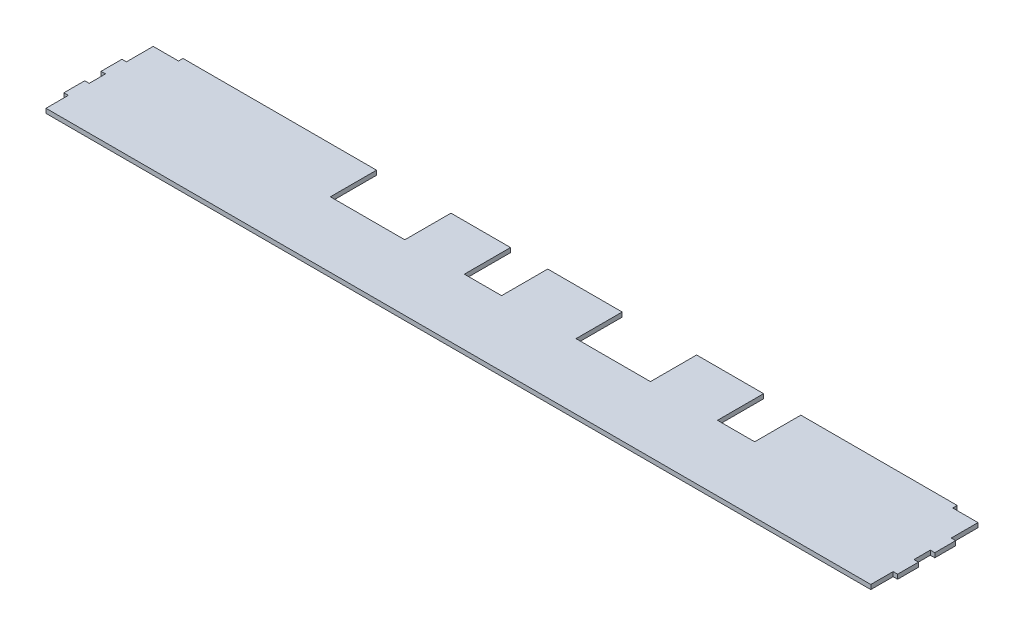
from build123d import *

# Parameters (mm, degrees)
SKETCH1_W           = 560
SKETCH1_H           = 75
BOSS_EXTRUDE1_DEPTH = 3
SKETCH2_W           = 50
SKETCH2_H           = 31
SKETCH2_W_2         = 25
CUT_EXTRUDE2_DEPTH  = 3
SKETCH3_W           = 20
SKETCH3_H           = 3
CUT_EXTRUDE3_DEPTH  = 3
SKETCH7_W           = 3
SKETCH7_H           = 15
SKETCH7_H_2         = 11
SKETCH7_H_3         = 18
CUT_EXTRUDE8_DEPTH  = 10


with BuildPart() as part:
    # Sketch1 → Boss-Extrude1 (new body)
    with BuildSketch(Plane(origin=(0, 0, 0), x_dir=(1, 0, 0), z_dir=(0, 1, 0))):
        with Locations((103.055832565, 47.017453799)):
            Rectangle(SKETCH1_W, SKETCH1_H)
    extrude(amount=BOSS_EXTRUDE1_DEPTH)

    # Sketch2 → Cut-Extrude2 (cut)
    with BuildSketch(Plane(origin=(0, 3, 0), x_dir=(1, 0, 0), z_dir=(0, 1, 0))):
        with Locations((-1.944167435, 69.017453799)):
            Rectangle(SKETCH2_W, SKETCH2_H)
        with Locations((75.555832565, 69.017453799)):
            Rectangle(SKETCH2_W_2, SKETCH2_H)
        with Locations((163.055832565, 69.017453799)):
            Rectangle(SKETCH2_W, SKETCH2_H)
        with Locations((245.555832565, 69.017453799)):
            Rectangle(SKETCH2_W_2, SKETCH2_H)
    extrude(amount=-CUT_EXTRUDE2_DEPTH, mode=Mode.SUBTRACT)

    # Sketch3 → Cut-Extrude3 (cut)
    with BuildSketch(Plane(origin=(0, 3, 0), x_dir=(1, 0, 0), z_dir=(0, 1, 0))):
        with Locations((-166.944167435, 83.017453799)):
            Rectangle(SKETCH3_W, SKETCH3_H)
    extrude(amount=-CUT_EXTRUDE3_DEPTH, mode=Mode.SUBTRACT)

    # Sketch7 → Cut-Extrude8 (cut)
    with BuildSketch(Plane(origin=(0, 3, 0), x_dir=(1, 0, 0), z_dir=(0, 1, 0))):
        with Locations((-175.444167435, 17.017453799)):
            Rectangle(SKETCH7_W, SKETCH7_H)
        with Locations((-175.444167435, 44.017453799)):
            Rectangle(SKETCH7_W, SKETCH7_H_2)
        with Locations((-175.444167435, 72.517453799)):
            Rectangle(SKETCH7_W, SKETCH7_H_3)
        with Locations((381.555832565, 17.017453799)):
            Rectangle(SKETCH7_W, SKETCH7_H)
        with Locations((381.555832565, 44.017453799)):
            Rectangle(SKETCH7_W, SKETCH7_H_2)
        with Locations((381.555832565, 72.517453799)):
            Rectangle(SKETCH7_W, SKETCH7_H_3)
        Polygon((383.055832565, 81.517453799), (383.055832565, 84.517453799), (363.055832565, 84.517453799), (363.055832565, 81.517453799), (380.055832565, 81.517453799), align=None)
    extrude(amount=-CUT_EXTRUDE8_DEPTH, mode=Mode.SUBTRACT)


solid = part.part
